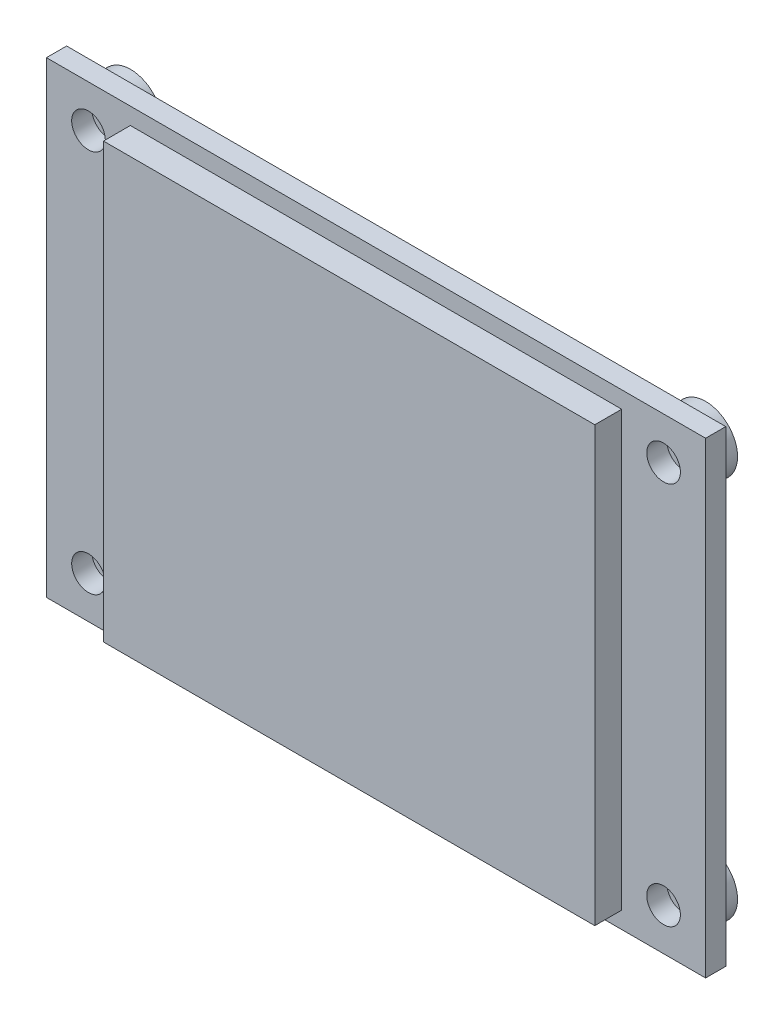
from build123d import *

# Parameters (mm, degrees)
MODULE_START                                    = 25.2
SKETCH_1_W                                      = 39.2
SKETCH_1_H                                      = 27.8
MODULE_PCB_DEPTH                                = 1.2
BACKLIGHT_START                                 = 26.4
SKETCH_2_W                                      = 29.22
SKETCH_2_H                                      = 25.8
BACKLIGHT_FRAME_DEPTH                           = 1
GLASS_START                                     = 27.4
SKETCH_3_W                                      = 29.22
SKETCH_3_H                                      = 25.8
GLASS_DEPTH                                     = 0.6
F_7_PIN_START                                   = 22.66
SKETCH_4_W                                      = 2.54
SKETCH_4_H                                      = 17.78
F_7_PIN_HEADER_PLASTIC_ON_THE_MODULE_BACK_DEPTH = 2.54
SKETCH_5_R                                      = 1
CORNER_HOLES_DEPTH                              = 82.935157289
M2_START                                        = 23.9
SKETCH_6_R                                      = 1.9
M2_SCREW_HEAD_DEPTH                             = 1.3
EXTRUDE_START                                   = 23.9
SKETCH_7_R                                      = 1.9
EXTRUDE_6_DEPTH                                 = 1.3
SKETCH_8_R                                      = 1.9
EXTRUDE_7_DEPTH                                 = 1.3
SKETCH_9_R                                      = 1.9
EXTRUDE_8_DEPTH                                 = 1.3


with BuildPart() as part:
    # 草圖1 → module PCB (new body)
    with BuildSketch(Plane.XY.offset(MODULE_START)):
        with Locations((30, 45)):
            Rectangle(SKETCH_1_W, SKETCH_1_H)
    extrude(amount=MODULE_PCB_DEPTH)

    # 草圖2 → backlight frame (add)
    with BuildSketch(Plane.XY.offset(BACKLIGHT_START)):
        with Locations((30, 45)):
            Rectangle(SKETCH_2_W, SKETCH_2_H)
    extrude(amount=BACKLIGHT_FRAME_DEPTH)

    # 草圖3 → glass (add)
    with BuildSketch(Plane.XY.offset(GLASS_START)):
        with Locations((30, 45)):
            Rectangle(SKETCH_3_W, SKETCH_3_H)
    extrude(amount=GLASS_DEPTH)

    # 草圖4 → 7-pin header plastic on the module back (add)
    with BuildSketch(Plane.XY.offset(F_7_PIN_START)):
        with Locations((12.9, 45)):
            Rectangle(SKETCH_4_W, SKETCH_4_H)
    extrude(amount=F_7_PIN_HEADER_PLASTIC_ON_THE_MODULE_BACK_DEPTH)

    # 草圖5 → corner holes (cut, through all)
    with BuildSketch(Plane.XY):
        with Locations((12.9, 33.6)):
            Circle(SKETCH_5_R)
        with Locations((12.9, 56.4)):
            Circle(SKETCH_5_R)
        with Locations((47.1, 33.6)):
            Circle(SKETCH_5_R)
        with Locations((47.1, 56.4)):
            Circle(SKETCH_5_R)
    extrude(amount=CORNER_HOLES_DEPTH, mode=Mode.SUBTRACT)

    # 草圖6 → M2 screw head (add)
    with BuildSketch(Plane.XY.offset(M2_START)):
        with Locations((12.9, 33.6)):
            Circle(SKETCH_6_R)
    extrude(amount=M2_SCREW_HEAD_DEPTH)

    # 草圖7 → 填料-伸長6 (add)
    with BuildSketch(Plane.XY.offset(EXTRUDE_START)):
        with Locations((12.9, 56.4)):
            Circle(SKETCH_7_R)
    extrude(amount=EXTRUDE_6_DEPTH)

    # 草圖8 → 填料-伸長7 (add)
    with BuildSketch(Plane.XY.offset(EXTRUDE_START)):
        with Locations((47.1, 33.6)):
            Circle(SKETCH_8_R)
    extrude(amount=EXTRUDE_7_DEPTH)

    # 草圖9 → 填料-伸長8 (add)
    with BuildSketch(Plane.XY.offset(EXTRUDE_START)):
        with Locations((47.1, 56.4)):
            Circle(SKETCH_9_R)
    extrude(amount=EXTRUDE_8_DEPTH)


solid = part.part
